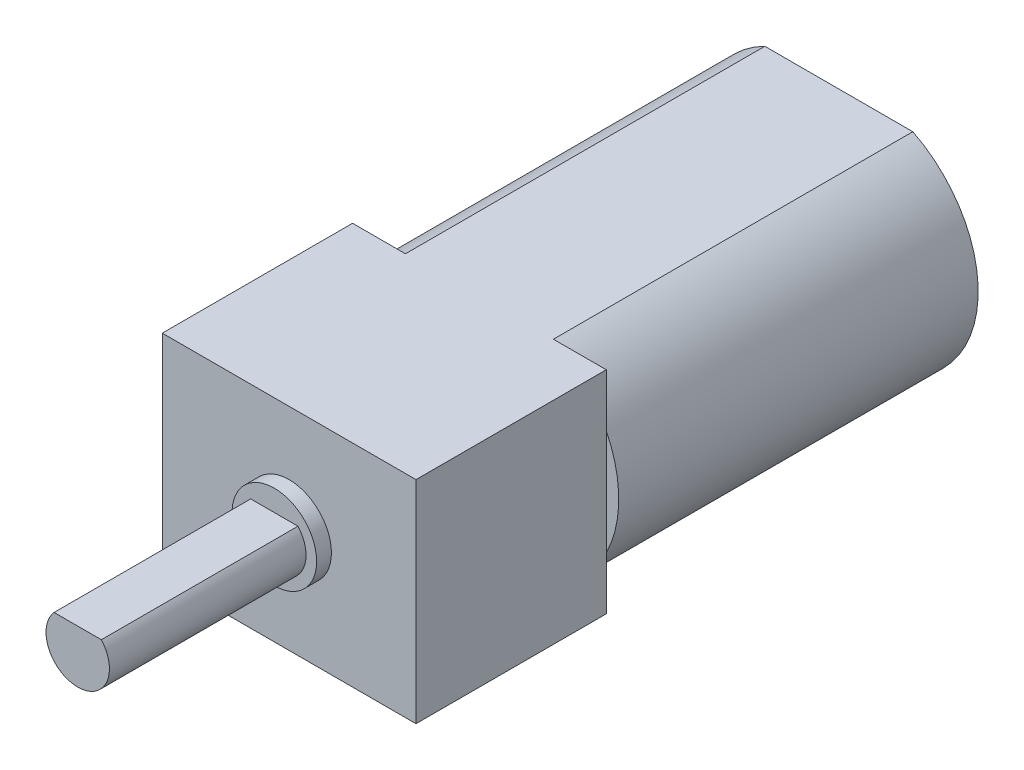
from build123d import *

# Parameters (mm, degrees)
RESSALTO_EXTRUS_O1_DEPTH = 17
ESBO_O2_W                = 12
ESBO_O2_H                = 10
RESSALTO_EXTRUS_O2_DEPTH = 9
ESBO_O3_R                = 2
RESSALTO_EXTRUS_O3_DEPTH = 0.7
ESBO_O4_R                = 1.5
RESSALTO_EXTRUS_O4_DEPTH = 9.3
CORTE_EXTRUS_O1_START    = -9.3
CORTE_EXTRUS_O1_DEPTH    = 9.3


with BuildPart() as part:
    # Esboço1 → Ressalto-extrusão1 (new body)
    with BuildSketch(Plane.XY):
        with BuildLine():
            Line((-3.5, 5), (3.5, 5))
            ThreePointArc((3.5, 5), (6.590169944, 0), (3.5, -5))
            Line((3.5, -5), (-3.5, -5))
            ThreePointArc((-3.5, -5), (-6.590169944, 0), (-3.5, 5))
        make_face()
    extrude(amount=-RESSALTO_EXTRUS_O1_DEPTH)

    # Esboço2 → Ressalto-extrusão2 (add)
    with BuildSketch(Plane.XY):
        Rectangle(ESBO_O2_W, ESBO_O2_H)
    extrude(amount=RESSALTO_EXTRUS_O2_DEPTH)

    # Esboço3 → Ressalto-extrusão3 (add)
    with BuildSketch(Plane.XY.offset(9)):
        Circle(ESBO_O3_R)
    extrude(amount=RESSALTO_EXTRUS_O3_DEPTH)

    # Esboço4 → Ressalto-extrusão4 (add)
    with BuildSketch(Plane.XY.offset(9.7)):
        Circle(ESBO_O4_R)
    extrude(amount=RESSALTO_EXTRUS_O4_DEPTH)

    # Esboço5 → Corte-extrusão1 (cut)
    with BuildSketch(Plane.XY.offset(19).offset(CORTE_EXTRUS_O1_START)):
        with BuildLine():
            Line((-1.118033989, 1), (1.118033989, 1))
            ThreePointArc((1.118033989, 1), (0, 1.5), (-1.118033989, 1))
        make_face()
    extrude(amount=CORTE_EXTRUS_O1_DEPTH, mode=Mode.SUBTRACT)


solid = part.part
